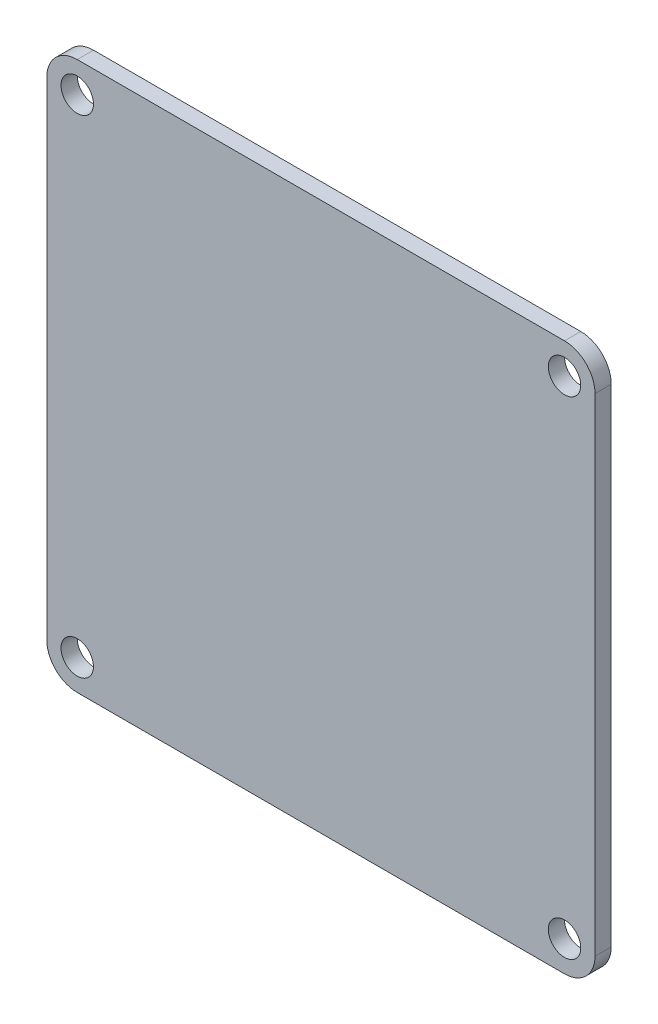
from build123d import *

# Parameters (mm, degrees)
SKETCH1_R           = 1.997398612
BOSS_EXTRUDE2_DEPTH = 2


with BuildPart() as part:
    # Sketch1 → Boss-Extrude2 (new body)
    with BuildSketch(Plane.XY):
        with BuildLine():
            Line((30, 33.75), (-30, 33.75))
            ThreePointArc((-30, 33.75), (-32.651650429, 32.651650429), (-33.75, 30))
            Line((-33.75, 30), (-33.75, -30))
            ThreePointArc((-33.75, -30), (-32.651650429, -32.651650429), (-30, -33.75))
            Line((-30, -33.75), (30, -33.75))
            ThreePointArc((30, -33.75), (32.651650429, -32.651650429), (33.75, -30))
            Line((33.75, -30), (33.75, 30))
            ThreePointArc((33.75, 30), (32.651650429, 32.651650429), (30, 33.75))
        make_face()
        with Locations((30, -30)):
            Circle(SKETCH1_R, mode=Mode.SUBTRACT)
        with Locations((30, 30)):
            Circle(SKETCH1_R, mode=Mode.SUBTRACT)
        with Locations((-30, 30)):
            Circle(SKETCH1_R, mode=Mode.SUBTRACT)
        with Locations((-30, -30)):
            Circle(SKETCH1_R, mode=Mode.SUBTRACT)
    extrude(amount=BOSS_EXTRUDE2_DEPTH)


solid = part.part
